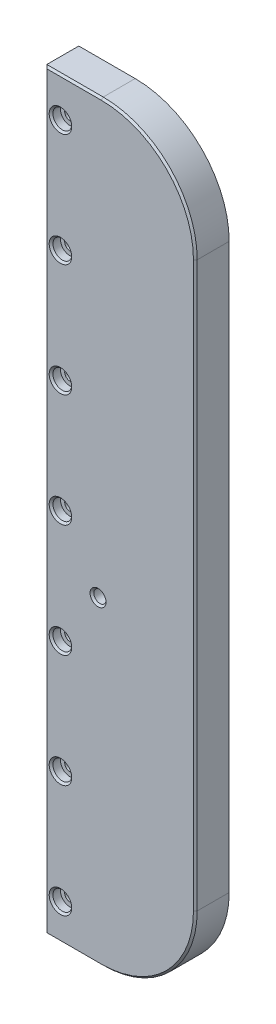
from build123d import *

# Parameters (mm, degrees)
SKETCH1_W                      = 80
SKETCH1_H                      = 400
BOSS_EXTRUDE1_DEPTH            = 18
FILLET1_R                      = 50
CBORE_FOR_M5_SHCS1_D           = 5.5
CBORE_FOR_M5_SHCS1_DEPTH       = 28.347633298
CBORE_FOR_M5_SHCS1_CBORE_D     = 10
CBORE_FOR_M5_SHCS1_CBORE_DEPTH = 5
CBORE_FOR_M5_SHCS1_TIP         = 1.652366702
CHAMFER1_SIZE                  = 1
SKETCH5_R                      = 3.25
CUT_EXTRUDE1_DEPTH             = 284.418418597
CHAMFER2_SIZE                  = 1


with BuildPart() as part:
    # Sketch1 → Boss-Extrude1 (new body)
    with BuildSketch(Plane.XY):
        with Locations((41, 71)):
            Rectangle(SKETCH1_W, SKETCH1_H)
    extrude(amount=BOSS_EXTRUDE1_DEPTH)

    # Fillet1
    fillet1_edges = [part.edges().sort_by_distance(p)[0] for p in [
        (81, 271, 9),
        (81, -129, 9),
    ]]
    fillet(fillet1_edges, radius=FILLET1_R)

    # CBORE for M5 SHCS1
    with Locations(Plane.XY.offset(18)):
        with Locations((9.25, 190), (9.25, 130), (9.25, 70), (9.25, 10), (9.25, -50), (9.25, -110), (9.25, 250)):
            CounterBoreHole(CBORE_FOR_M5_SHCS1_D / 2, CBORE_FOR_M5_SHCS1_CBORE_D / 2, CBORE_FOR_M5_SHCS1_CBORE_DEPTH, depth=CBORE_FOR_M5_SHCS1_DEPTH)
            with Locations((0, 0, -(CBORE_FOR_M5_SHCS1_DEPTH + CBORE_FOR_M5_SHCS1_TIP / 2))):  # 118° drill point
                Cone(0, CBORE_FOR_M5_SHCS1_D / 2, CBORE_FOR_M5_SHCS1_TIP, mode=Mode.SUBTRACT)

    # Chamfer1
    chamfer1_edges = [part.edges().sort_by_distance(p)[0] for p in [
        (16, 271, 18),
        (81, 71, 18),
        (66.355339059, -114.355339059, 18),
        (66.355339059, 256.355339059, 18),
        (4.25, 250, 18),
        (4.25, -110, 18),
        (4.25, -50, 18),
        (1, 71, 18),
        (4.25, 10, 18),
        (4.25, 70, 18),
        (4.25, 130, 18),
        (4.25, 190, 18),
        (16, -129, 18),
    ]]
    chamfer(chamfer1_edges, length=CHAMFER1_SIZE)

    # Sketch5 → Cut-Extrude1 (cut, through all)
    with BuildSketch(Plane.XY.offset(18)):
        with Locations((29.25, 40)):
            Circle(SKETCH5_R)
    extrude(amount=-CUT_EXTRUDE1_DEPTH, mode=Mode.SUBTRACT)

    # Chamfer2
    chamfer2_edges = [part.edges().sort_by_distance(p)[0] for p in [
        (26, 40, 0),
        (26, 40, 18),
    ]]
    chamfer(chamfer2_edges, length=CHAMFER2_SIZE)


solid = part.part
